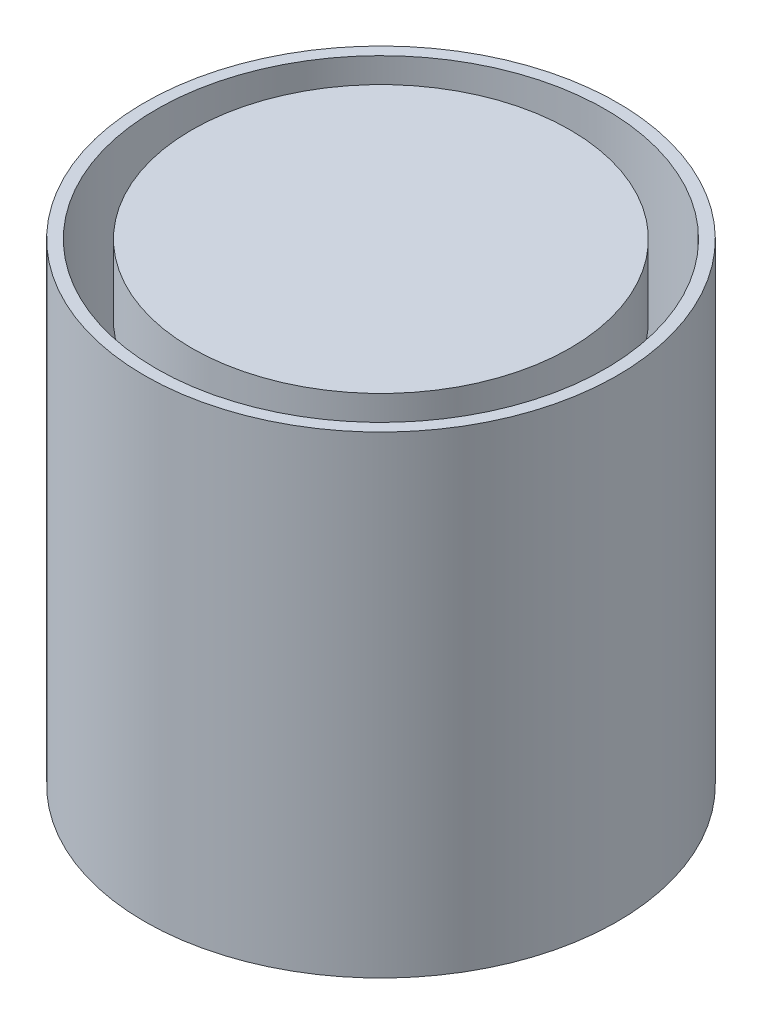
from build123d import *

# Parameters (mm, degrees)
SKETCH_6_R      = 100
SKETCH_6_R_2    = 95
EXTRUDE_1_DEPTH = 200
SKETCH_7_R      = 80
EXTRUDE_2_DEPTH = 30


with BuildPart() as part:
    # 草图6 → 凸台-拉伸1 (new body)
    with BuildSketch(Plane(origin=(0, 0, 0), x_dir=(1, 0, 0), z_dir=(0, 1, 0))):
        with Locations(Location((0, 0, 0), (0, 0, 270))):
            Circle(SKETCH_6_R)
        with Locations(Location((0, 0, 0), (0, 0, 270))):
            Circle(SKETCH_6_R_2, mode=Mode.SUBTRACT)
    extrude(amount=-EXTRUDE_1_DEPTH)


with BuildPart() as body_2:
    # 草图7 → 凸台-拉伸2 (new body)
    with BuildSketch(Plane(origin=(0, 0, 0), x_dir=(1, 0, 0), z_dir=(0, 1, 0))):
        with Locations(Location((0, 0, 0), (0, 0, 270))):
            Circle(SKETCH_7_R)
    extrude(amount=-EXTRUDE_2_DEPTH)


solid = Compound([part.part, body_2.part])
